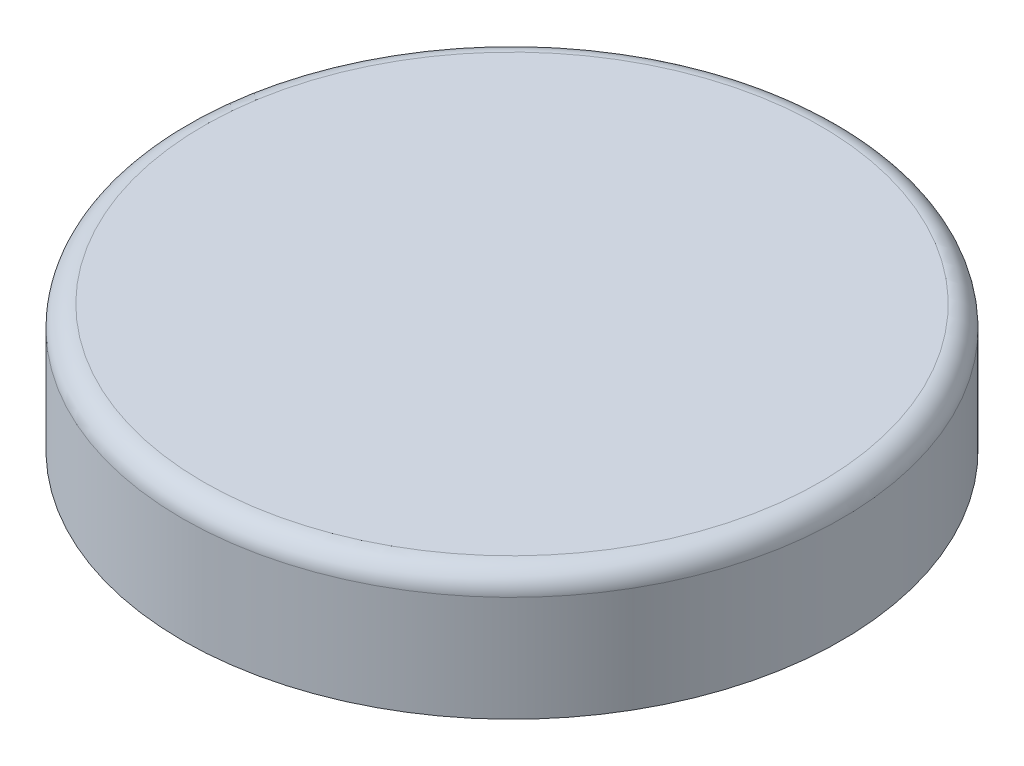
from build123d import *

# Parameters (mm, degrees)
SKETCH1_R           = 78.068547275
BOSS_EXTRUDE1_DEPTH = 30
FILLET1_R           = 5


with BuildPart() as part:
    # Sketch1 → Boss-Extrude1 (new body)
    with BuildSketch(Plane(origin=(0, 0, 0), x_dir=(1, 0, 0), z_dir=(0, 1, 0))):
        with Locations(Location((0, 0, 0), (0, 0, 270))):
            Circle(SKETCH1_R)
    extrude(amount=BOSS_EXTRUDE1_DEPTH)

    # Fillet1
    fillet1_edges = [part.edges().sort_by_distance(p)[0] for p in [
        (0, 30, -78.068547275),
    ]]
    fillet(fillet1_edges, radius=FILLET1_R)


solid = part.part
